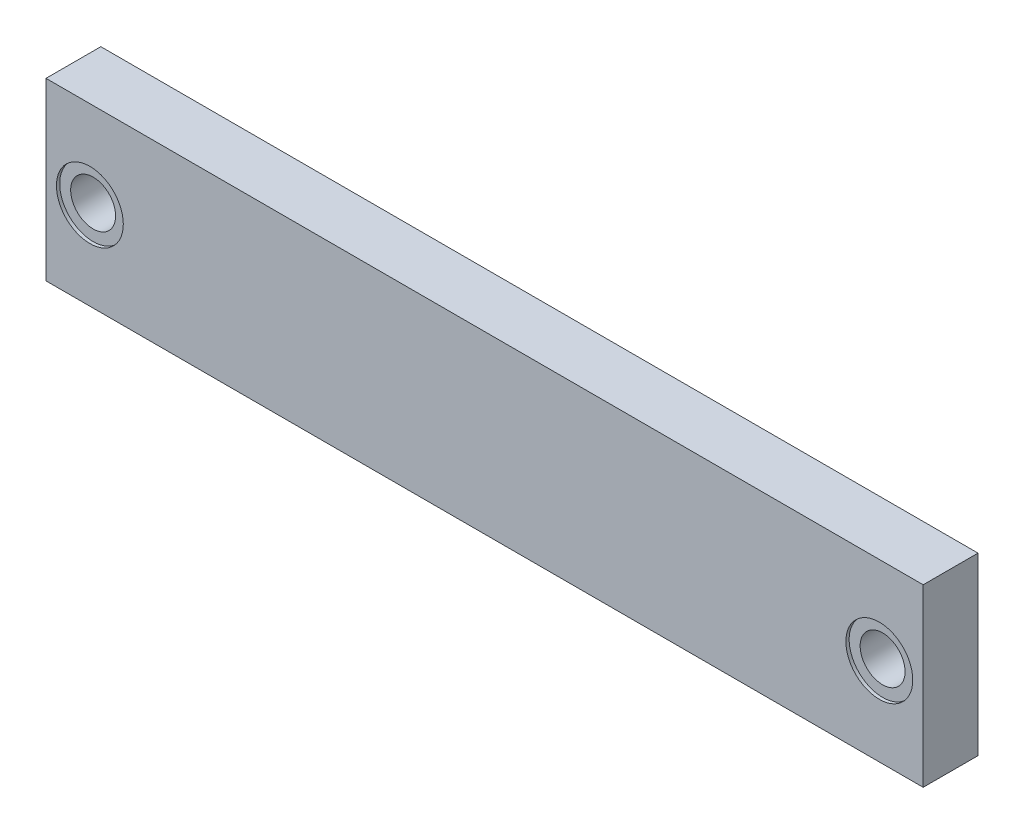
from build123d import *

# Parameters (mm, degrees)
INSTALLED_SPRING_STRIP_SKETCH_W = 80
INSTALLED_SPRING_STRIP_SKETCH_H = 16
INSTALLED_SPRING_STRIP_DEPTH    = 5
EYELET_CLEARANCE_1_SKETCH_R     = 2.05
EYELET_CLEARANCE_1_DEPTH        = 5.2
FLANGE_RECESS_1_1_SKETCH_R      = 3.05
FLANGE_RECESS_1_1_DEPTH         = 0.4
FLANGE_RECESS_1_2_SKETCH_R      = 3.05
FLANGE_RECESS_1_2_DEPTH         = 0.4
EYELET_CLEARANCE_2_SKETCH_R     = 2.05
EYELET_CLEARANCE_2_DEPTH        = 5.2
FLANGE_RECESS_2_1_SKETCH_R      = 3.05
FLANGE_RECESS_2_1_DEPTH         = 0.4
FLANGE_RECESS_2_2_SKETCH_R      = 3.05
FLANGE_RECESS_2_2_DEPTH         = 0.4


with BuildPart() as part:
    # Installed spring strip sketch → Installed spring strip (new body)
    with BuildSketch(Plane.XY.offset(12.5)):
        with Locations((-0.291651246, -12)):
            Rectangle(INSTALLED_SPRING_STRIP_SKETCH_W, INSTALLED_SPRING_STRIP_SKETCH_H)
    extrude(amount=INSTALLED_SPRING_STRIP_DEPTH)

    # Eyelet clearance 1 sketch → Eyelet clearance 1 (cut)
    with BuildSketch(Plane.XY.offset(12.4)):
        with Locations((-36.291651246, -12)):
            Circle(EYELET_CLEARANCE_1_SKETCH_R)
    extrude(amount=EYELET_CLEARANCE_1_DEPTH, mode=Mode.SUBTRACT)

    # Flange recess 1-1 sketch → Flange recess 1-1 (cut)
    with BuildSketch(Plane.XY.offset(12.4)):
        with Locations((-36.291651246, -12)):
            Circle(FLANGE_RECESS_1_1_SKETCH_R)
    extrude(amount=FLANGE_RECESS_1_1_DEPTH, mode=Mode.SUBTRACT)

    # Flange recess 1-2 sketch → Flange recess 1-2 (cut)
    with BuildSketch(Plane.XY.offset(17.2)):
        with Locations((-36.291651246, -12)):
            Circle(FLANGE_RECESS_1_2_SKETCH_R)
    extrude(amount=FLANGE_RECESS_1_2_DEPTH, mode=Mode.SUBTRACT)

    # Eyelet clearance 2 sketch → Eyelet clearance 2 (cut)
    with BuildSketch(Plane.XY.offset(12.4)):
        with Locations((35.708348754, -12)):
            Circle(EYELET_CLEARANCE_2_SKETCH_R)
    extrude(amount=EYELET_CLEARANCE_2_DEPTH, mode=Mode.SUBTRACT)

    # Flange recess 2-1 sketch → Flange recess 2-1 (cut)
    with BuildSketch(Plane.XY.offset(12.4)):
        with Locations((35.708348754, -12)):
            Circle(FLANGE_RECESS_2_1_SKETCH_R)
    extrude(amount=FLANGE_RECESS_2_1_DEPTH, mode=Mode.SUBTRACT)

    # Flange recess 2-2 sketch → Flange recess 2-2 (cut)
    with BuildSketch(Plane.XY.offset(17.2)):
        with Locations((35.708348754, -12)):
            Circle(FLANGE_RECESS_2_2_SKETCH_R)
    extrude(amount=FLANGE_RECESS_2_2_DEPTH, mode=Mode.SUBTRACT)


solid = part.part
